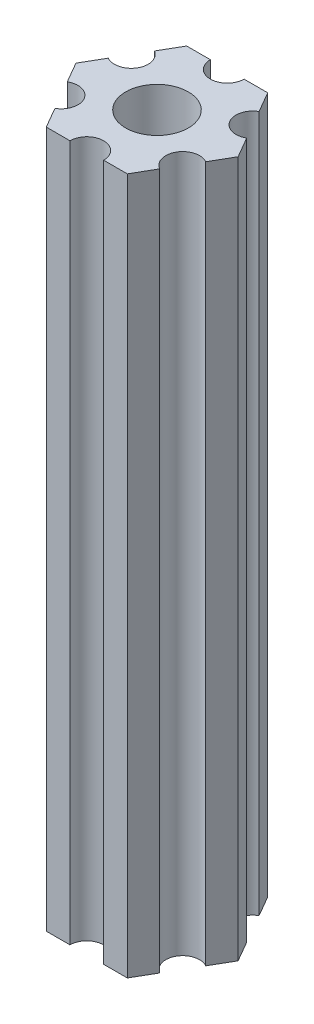
from build123d import *

# Parameters (mm, degrees)
ESBO_O1_R                = 2.79
RESSALTO_EXTRUS_O1_DEPTH = 62


with BuildPart() as part:
    # Esboço1 → Ressalto-extrusão1 (new body)
    with BuildSketch(Plane(origin=(0, 85, 0), x_dir=(1, 0, 0), z_dir=(0, 1, 0))):
        with BuildLine():
            Line((6.162658774, -1.825961894), (7.216878365, 0))
            Line((7.216878365, 0), (6.162658774, 1.825961894))
            ThreePointArc((6.162658774, 1.825961894), (4.113620668, 2.375), (4.662658774, 4.424038106))
            Line((4.662658774, 4.424038106), (3.608439182, 6.25))
            Line((3.608439182, 6.25), (1.5, 6.25))
            ThreePointArc((1.5, 6.25), (0, 4.75), (-1.5, 6.25))
            Line((-1.5, 6.25), (-3.608439182, 6.25))
            Line((-3.608439182, 6.25), (-4.662658774, 4.424038106))
            ThreePointArc((-4.662658774, 4.424038106), (-4.113620668, 2.375), (-6.162658774, 1.825961894))
            Line((-6.162658774, 1.825961894), (-7.216878365, 0))
            Line((-7.216878365, 0), (-6.162658774, -1.825961894))
            ThreePointArc((-6.162658774, -1.825961894), (-4.113620668, -2.375), (-4.662658774, -4.424038106))
            Line((-4.662658774, -4.424038106), (-3.608439182, -6.25))
            Line((-3.608439182, -6.25), (-1.5, -6.25))
            ThreePointArc((-1.5, -6.25), (0, -4.75), (1.5, -6.25))
            Line((1.5, -6.25), (3.608439182, -6.25))
            Line((3.608439182, -6.25), (4.662658774, -4.424038106))
            ThreePointArc((4.662658774, -4.424038106), (4.113620668, -2.375), (6.162658774, -1.825961894))
        make_face()
        with Locations(Location((0, 0, 0), (0, 0, 90))):
            Circle(ESBO_O1_R, mode=Mode.SUBTRACT)
    extrude(amount=-RESSALTO_EXTRUS_O1_DEPTH)


solid = part.part
